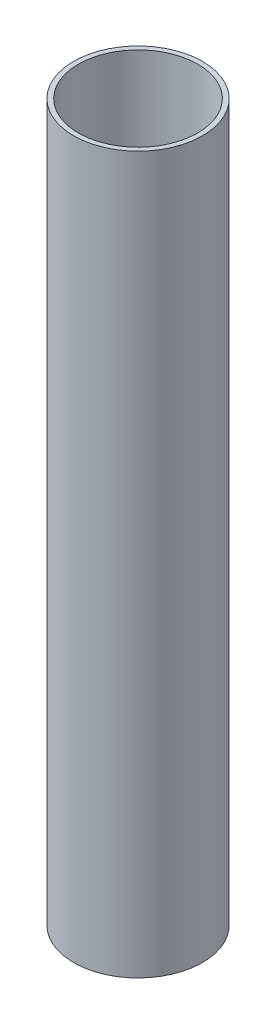
from build123d import *

# Parameters (mm, degrees)
SKETCH2_R           = 6.858
SKETCH2_R_2         = 6.35
BOSS_EXTRUDE1_DEPTH = 76.2


with BuildPart() as part:
    # Sketch2 → Boss-Extrude1 (new body)
    with BuildSketch(Plane(origin=(0, 0, 0), x_dir=(1, 0, 0), z_dir=(0, 1, 0))):
        with Locations(Location((0, 0, 0), (0, 0, 90))):
            Circle(SKETCH2_R)
        with Locations(Location((0, 0, 0), (0, 0, 90))):
            Circle(SKETCH2_R_2, mode=Mode.SUBTRACT)
    extrude(amount=BOSS_EXTRUDE1_DEPTH)


solid = part.part
